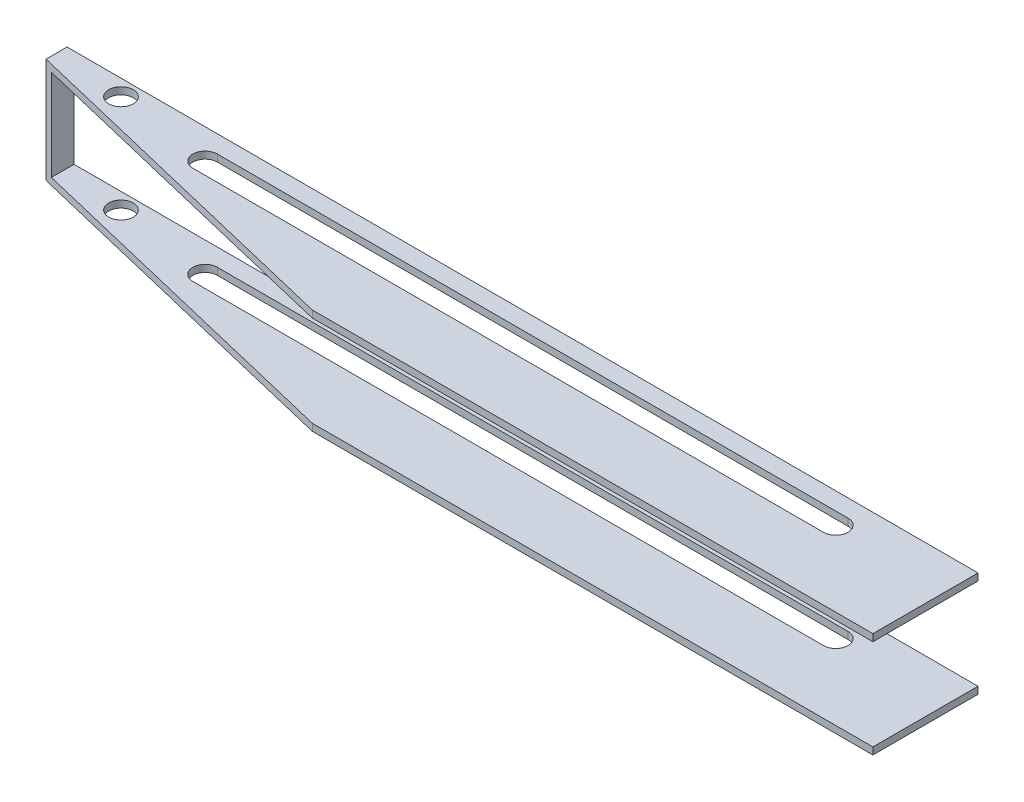
from build123d import *

# Parameters (mm, degrees)
BOSS_EXTRUDE1_DEPTH = 15
CUT_EXTRUDE1_DEPTH  = 73.629551255
SKETCH8_R           = 1.75
CUT_EXTRUDE2_DEPTH  = 73.629551255
CUT_EXTRUDE4_DEPTH  = 73.629551255


with BuildPart() as part:
    # Sketch3 → Boss-Extrude1 (new body)
    with BuildSketch(Plane.XY):
        Polygon((-60.537407798, -1.859852476), (69.462592202, -1.859852476), (69.462592202, -2.859852476), (-59.537407798, -2.859852476), (-59.537407798, -15.859852476), (69.462592202, -15.859852476), (69.462592202, -16.859852476), (-60.537407798, -16.859852476), align=None)
    extrude(amount=-BOSS_EXTRUDE1_DEPTH)

    # Sketch6 → Cut-Extrude1 (cut, through all)
    with BuildSketch(Plane(origin=(0, -1.859852476, 0), x_dir=(1, 0, 0), z_dir=(0, 1, 0))):
        Polygon((-60.537407798, 12), (-10.537407798, 0), (-10.537407798, -10.064923469), (-60.537407798, -10.064923469), align=None)
    extrude(amount=-CUT_EXTRUDE1_DEPTH, mode=Mode.SUBTRACT)

    # Sketch8 → Cut-Extrude2 (cut, through all)
    with BuildSketch(Plane(origin=(0, -1.859852476, 0), x_dir=(1, 0, 0), z_dir=(0, 1, 0))):
        with Locations(Location((-50.537407798, 12.7, 0), (0, 0, 270))):
            Circle(SKETCH8_R)
    extrude(amount=-CUT_EXTRUDE2_DEPTH, mode=Mode.SUBTRACT)

    # Sketch12 → Cut-Extrude4 (cut, through all)
    with BuildSketch(Plane.XZ.offset(16.859852476)):
        with BuildLine():
            Line((53.415401878, -12.5), (-36.584598122, -12.5))
            ThreePointArc((-36.584598122, -12.5), (-38.334598122, -10.75), (-36.584598122, -9))
            Line((-36.584598122, -9), (53.415401878, -9))
            ThreePointArc((53.415401878, -9), (55.165401878, -10.75), (53.415401878, -12.5))
        make_face()
    extrude(amount=-CUT_EXTRUDE4_DEPTH, mode=Mode.SUBTRACT)


solid = part.part
